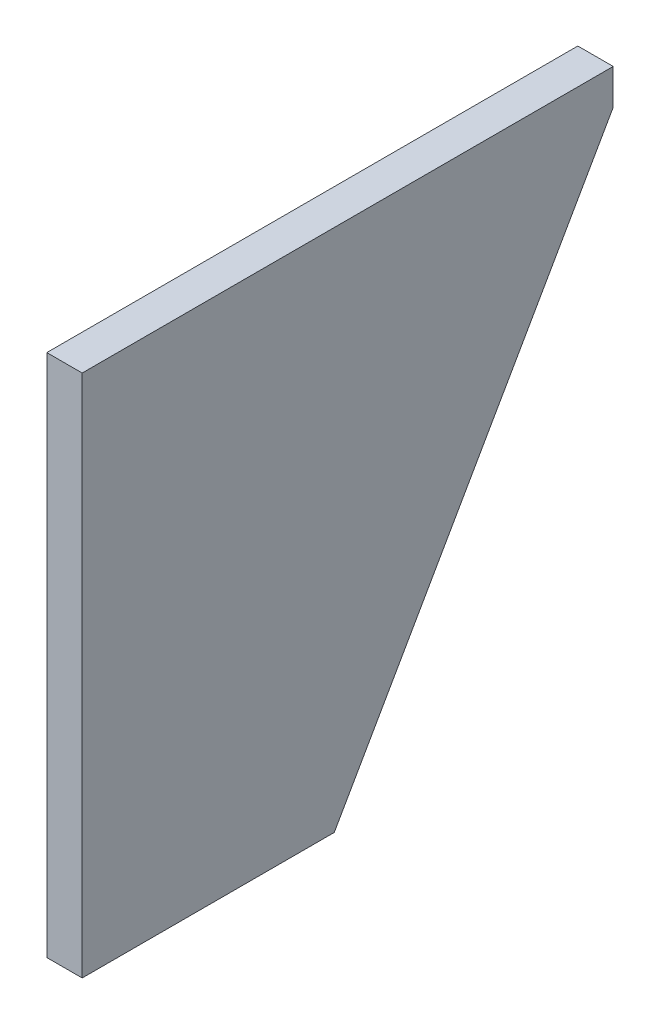
from build123d import *

# Parameters (mm, degrees)
SALIENTE_EXTRUIR1_DEPTH      = 5
SALIENTE_EXTRUIR1_DEPTH_BACK = 20


with BuildPart() as part:
    # Croquis2 → Saliente-Extruir1 (new, two sides: drawn at the far end of the back side and taken through both)
    with BuildSketch(Plane.ZY.offset(192.754092983).offset(-SALIENTE_EXTRUIR1_DEPTH_BACK)):
        Polygon((334.847231333, 111.353262199), (334.847231333, -258.646737801), (156.847231333, -258.646737801), (-40.152768667, 86.353262199), (-40.152768667, 111.353262199), align=None)
    extrude(amount=SALIENTE_EXTRUIR1_DEPTH + SALIENTE_EXTRUIR1_DEPTH_BACK)


solid = part.part
